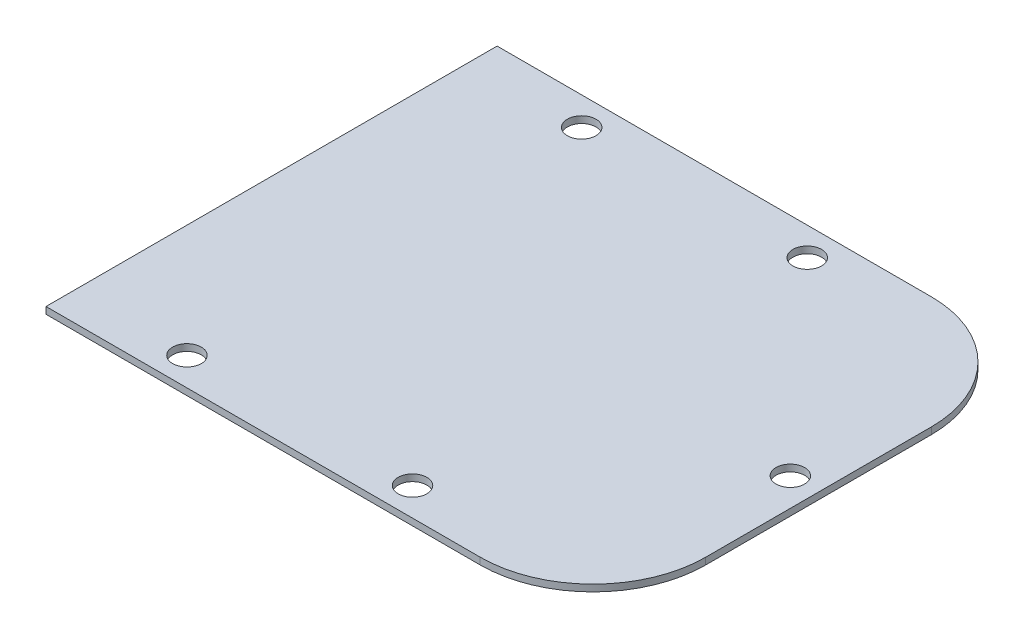
from build123d import *

# Parameters (mm, degrees)
SKETCH1_W                 = 30.7975
SKETCH1_H                 = 25.4
BOSS_EXTRUDE1_DEPTH       = 0.381
FILLET1_R                 = 6.35
F_0_CLEARANCE_HOLE1_D     = 1.6129
F_0_CLEARANCE_HOLE1_DEPTH = 25.4
F_0_CLEARANCE_HOLE1_TIP   = 0.484564046


with BuildPart() as part:
    # Sketch1 → Boss-Extrude1 (new body)
    with BuildSketch(Plane(origin=(0, 0, 0), x_dir=(1, 0, 0), z_dir=(0, 1, 0))):
        Rectangle(SKETCH1_W, SKETCH1_H)
    extrude(amount=BOSS_EXTRUDE1_DEPTH)

    # Fillet1
    fillet1_edges = [part.edges().sort_by_distance(p)[0] for p in [
        (15.39875, 0.1905, 12.7),
        (15.39875, 0.1905, -12.7),
    ]]
    fillet(fillet1_edges, radius=FILLET1_R)

    # #0 Clearance Hole1
    with Locations(Plane(origin=(0, 0.381, 0), x_dir=(-1, 0, 0), z_dir=(0, 1, 0))):
        with Locations((9.04875, -11.1125), (-3.65125, -11.1125), (-13.81125, 0), (9.04875, 11.1125), (-3.65125, 11.1125)):
            Hole(F_0_CLEARANCE_HOLE1_D / 2, depth=F_0_CLEARANCE_HOLE1_DEPTH)
            with Locations((0, 0, -(F_0_CLEARANCE_HOLE1_DEPTH + F_0_CLEARANCE_HOLE1_TIP / 2))):  # 118° drill point
                Cone(0, F_0_CLEARANCE_HOLE1_D / 2, F_0_CLEARANCE_HOLE1_TIP, mode=Mode.SUBTRACT)


solid = part.part
